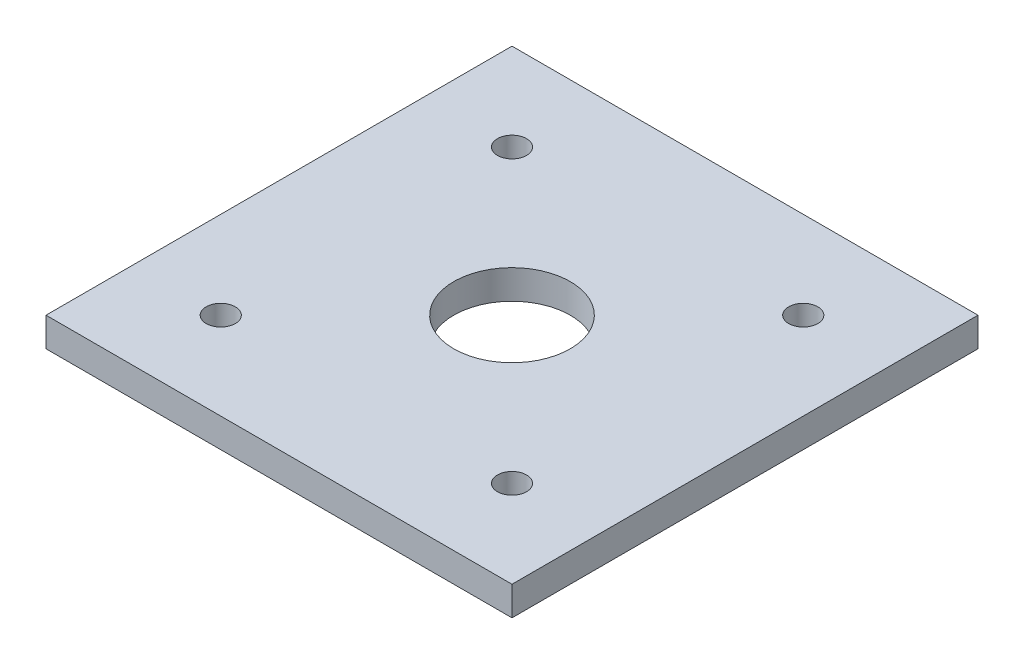
from build123d import *

# Parameters (mm, degrees)
SKETCH1_W                   = 101.6
SKETCH1_H                   = 101.6
SKETCH1_R                   = 12.7
BOSS_EXTRUDE1_DEPTH         = 6.35
F_1_4_0_25_DIAMETER_HOLE1_D = 6.35
CIRPATTERN1_COUNT           = 4


with BuildPart() as part:
    # Sketch1 → Boss-Extrude1 (new body)
    with BuildSketch(Plane(origin=(0, 0, 0), x_dir=(1, 0, 0), z_dir=(0, 1, 0))):
        Rectangle(SKETCH1_W, SKETCH1_H)
        with Locations(Location((0, 0, 0), (0, 0, 270))):
            Circle(SKETCH1_R, mode=Mode.SUBTRACT)
    extrude(amount=BOSS_EXTRUDE1_DEPTH)

    # 1/4 (0.25) Diameter Hole1 (through all)
    with Locations(Plane(origin=(0, 6.35, 0), x_dir=(1, 0, 0), z_dir=(0, 1, 0))):
        with Locations((-31.75, -31.75)):
            f_1_4_0_25_diameter_hole1 = Hole(F_1_4_0_25_DIAMETER_HOLE1_D / 2)

    # CirPattern1: 1/4 (0.25) Diameter Hole1 ×4 about axis
    cirpattern1_axis = Axis((0, 0, 0), (0, 1, 0))
    for i in range(1, CIRPATTERN1_COUNT):
        add(f_1_4_0_25_diameter_hole1.rotate(cirpattern1_axis, i * 360 / CIRPATTERN1_COUNT), mode=Mode.SUBTRACT)


solid = part.part
